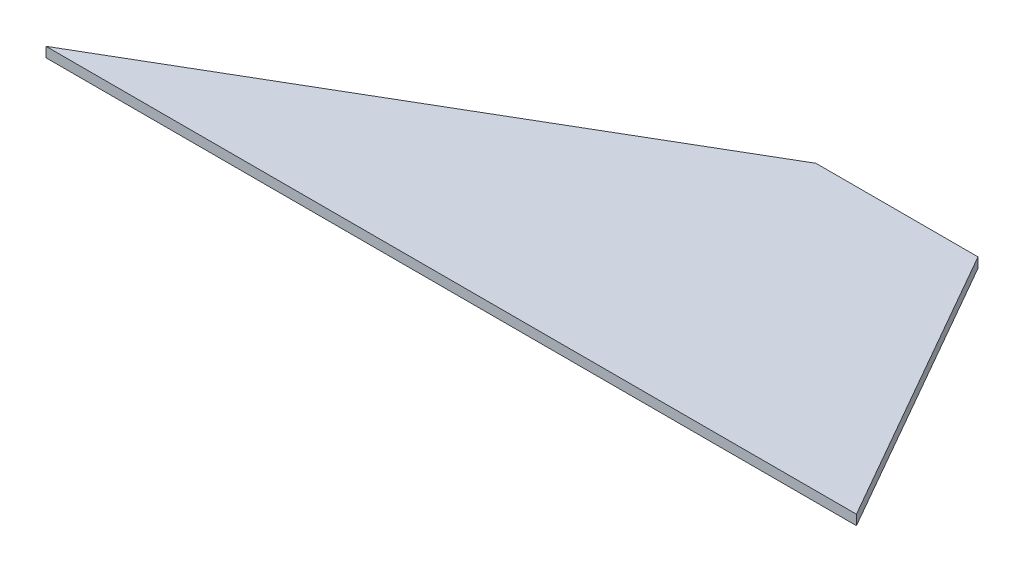
from build123d import *

# Parameters (mm, degrees)
BOSS_EXTRUDE1_DEPTH = 3.1242


with BuildPart() as part:
    # Sketch1 → Boss-Extrude1 (new body)
    with BuildSketch(Plane(origin=(0, 0, 0), x_dir=(1, 0, 0), z_dir=(0, 1, 0))):
        Polygon((0, 0), (254, 0), (203.2, 88.9), (152.4, 88.9), align=None)
    extrude(amount=BOSS_EXTRUDE1_DEPTH)


solid = part.part
